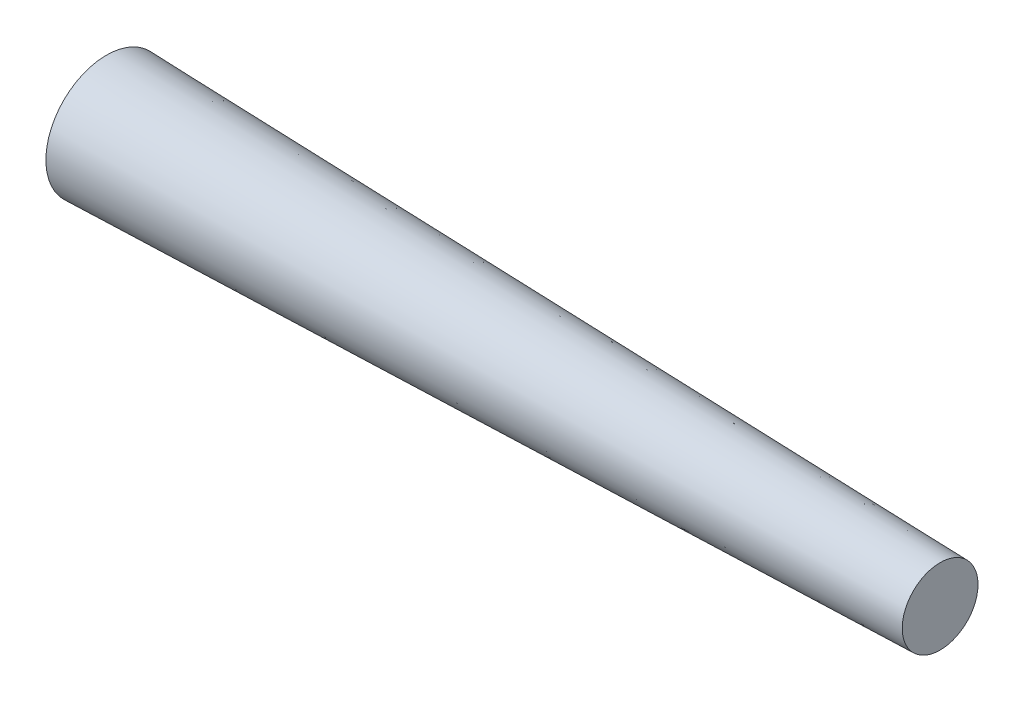
from build123d import *


with BuildPart() as part:
    # Sketch1 → Revolve1 (revolve)
    with BuildSketch(Plane.XY, mode=Mode.PRIVATE) as revolve1_sk:
        Polygon((0, 0), (0, 8), (110, 5), (110, 0), align=None)
    revolve(revolve1_sk.sketch.rotate(Axis((0, 0, 0), (-1, 0, 0)), 90), axis=Axis((0, 0, 0), (-1, 0, 0)))


solid = part.part
